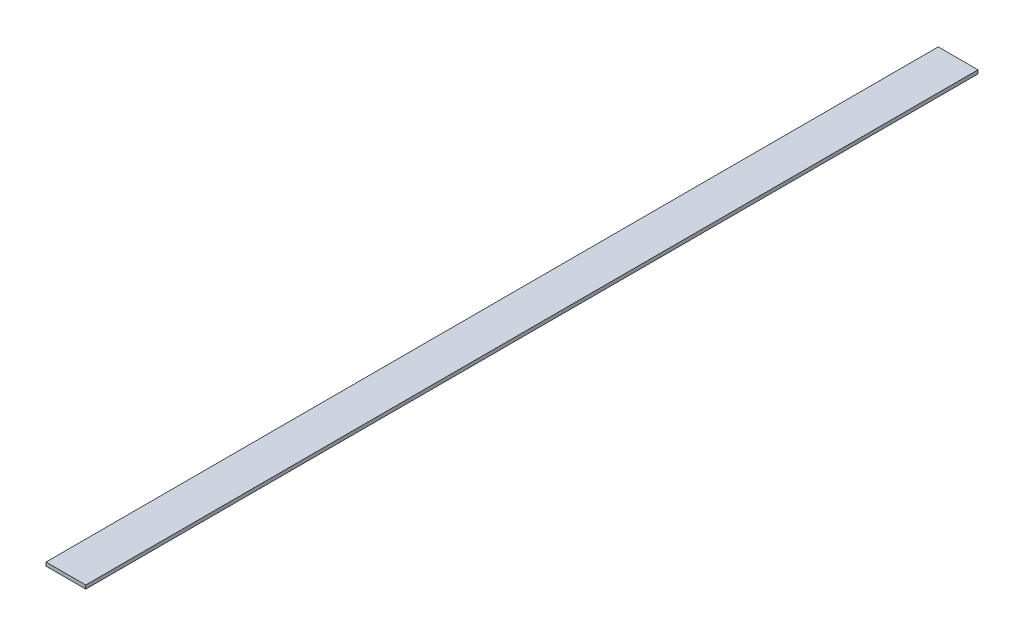
from build123d import *

# Parameters (mm, degrees)
SKETCH1_W           = 110
SKETCH1_H           = 10
BOSS_EXTRUDE1_DEPTH = 2470


with BuildPart() as part:
    # Sketch1 → Boss-Extrude1 (new body)
    with BuildSketch(Plane.XY):
        with Locations((55, -5)):
            Rectangle(SKETCH1_W, SKETCH1_H)
    extrude(amount=BOSS_EXTRUDE1_DEPTH)


solid = part.part
